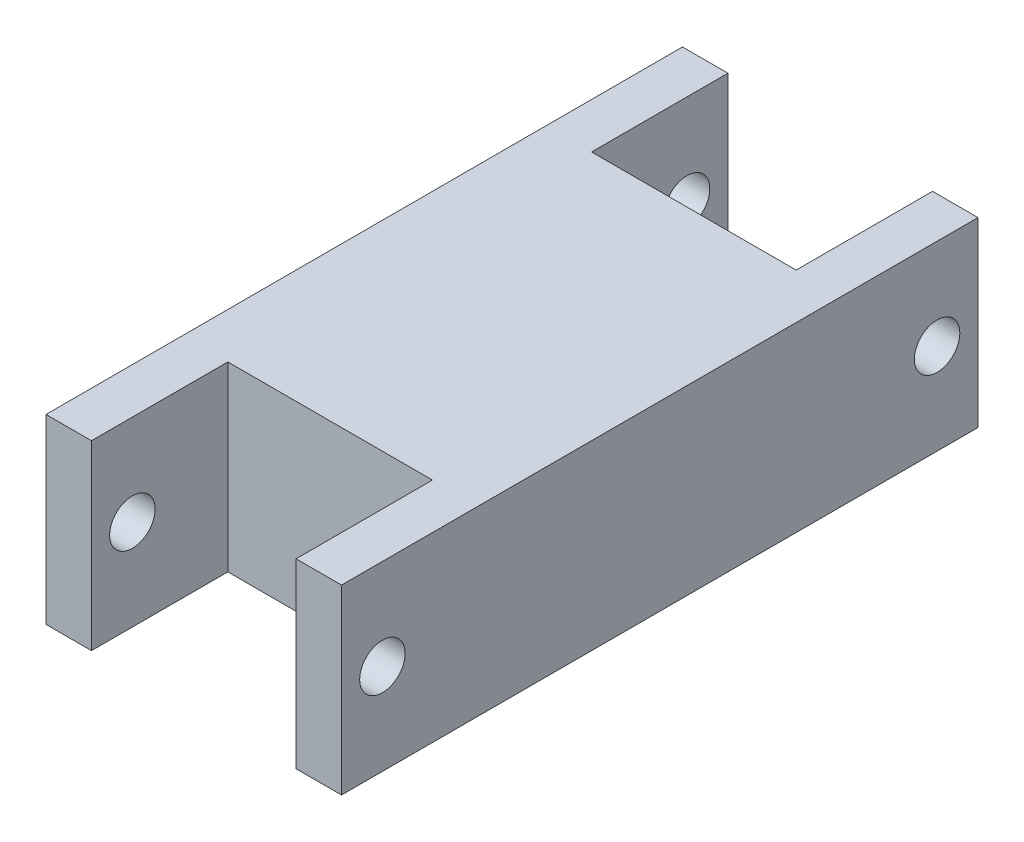
from build123d import *

# Parameters (mm, degrees)
BOSS_EXTRUDE1_DEPTH = 40
CUT_EXTRUDE1_REACH  = 105.562
SKETCH3_R           = 5


with BuildPart() as part:
    # Sketch2 → Boss-Extrude1 (new body)
    with BuildSketch(Plane(origin=(0, 0, 0), x_dir=(1, 0, 0), z_dir=(0, 1, 0))):
        Polygon((-22.5, 70), (-22.5, 40), (22.5, 40), (22.5, 70), (32.5, 70), (32.5, -70), (22.5, -70), (22.5, -40), (-22.5, -40), (-22.5, -70), (-32.5, -70), (-32.5, 70), align=None)
    extrude(amount=BOSS_EXTRUDE1_DEPTH)

    # Cut-Extrude1: up to this face of the body (flat: up to its plane)
    cut_extrude1_end = Plane(part.part.faces().sort_by_distance((-32.5, 20, 0))[0])
    # Sketch3 → Cut-Extrude1 (cut, up to the picked face)
    with BuildSketch(Plane(origin=(32.5, 0, 0), x_dir=(0, 0, -1), z_dir=(1, 0, 0)), mode=Mode.PRIVATE) as cut_extrude1_sk1:
        with Locations((-61, 20)):
            Circle(SKETCH3_R)
    cut_extrude1_tool1 = split(extrude(cut_extrude1_sk1.sketch, amount=-CUT_EXTRUDE1_REACH, mode=Mode.PRIVATE), bisect_by=cut_extrude1_end, keep=Keep.BOTH, mode=Mode.PRIVATE)
    # Sketch3 → Cut-Extrude1 (cut, up to the picked face)
    with BuildSketch(Plane(origin=(32.5, 0, 0), x_dir=(0, 0, -1), z_dir=(1, 0, 0)), mode=Mode.PRIVATE) as cut_extrude1_sk2:
        with Locations((61, 20)):
            Circle(SKETCH3_R)
    cut_extrude1_tool2 = split(extrude(cut_extrude1_sk2.sketch, amount=-CUT_EXTRUDE1_REACH, mode=Mode.PRIVATE), bisect_by=cut_extrude1_end, keep=Keep.BOTH, mode=Mode.PRIVATE)
    add(cut_extrude1_tool1.solids().sort_by(Axis((32.5, 20, 61), (-1, 0, 0)))[0], mode=Mode.SUBTRACT)
    add(cut_extrude1_tool2.solids().sort_by(Axis((32.5, 20, -61), (-1, 0, 0)))[0], mode=Mode.SUBTRACT)


solid = part.part
